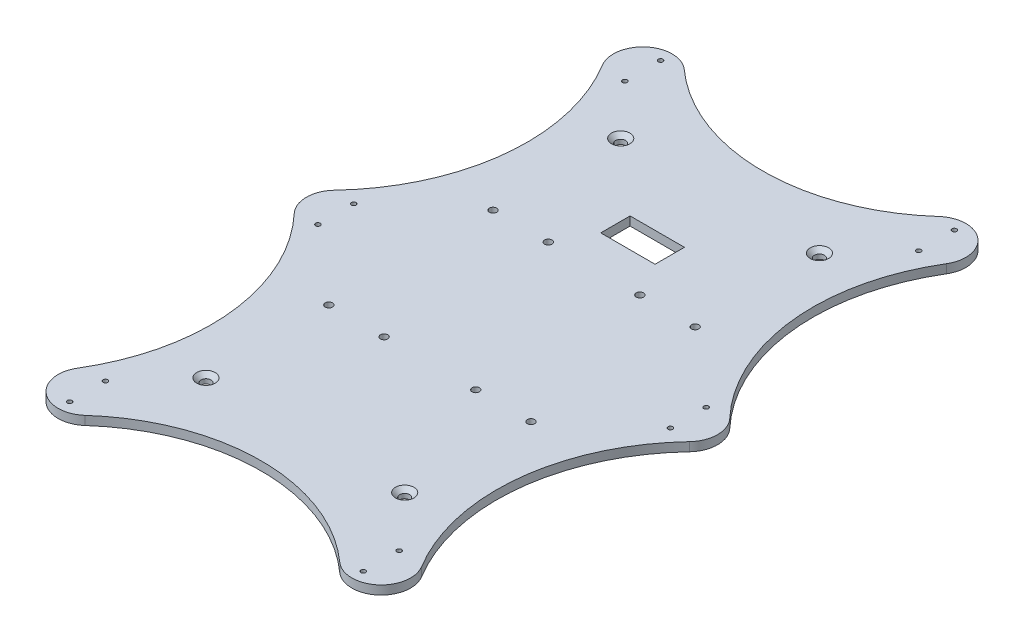
from build123d import *

# Parameters (mm, degrees)
SKETCH1_R                                      = 0.79375
SKETCH1_R_2                                    = 1.25
BOSS_EXTRUDE1_DEPTH                            = 3
CSK_FOR_M3_FLAT_HEAD_MACHINE_SCREW1_AT_2_COUNT = 2
CSK_FOR_M3_FLAT_HEAD_MACHINE_SCREW1_AT_2_PITCH = 67.658315793
CSK_FOR_M3_FLAT_HEAD_MACHINE_SCREW1_AT_3_COUNT = 2
CSK_FOR_M3_FLAT_HEAD_MACHINE_SCREW1_AT_3_PITCH = 141.2
CSK_FOR_M3_FLAT_HEAD_MACHINE_SCREW1_AT_4_COUNT = 2
CSK_FOR_M3_FLAT_HEAD_MACHINE_SCREW1_AT_4_PITCH = 156.572946884
CUT_EXTRUDE1_REACH                             = 127.831
SKETCH5_W                                      = 18.5
SKETCH5_H                                      = 10


with BuildPart() as part:
    # Sketch1 → Boss-Extrude1 (new body)
    with BuildSketch(Plane(origin=(0, 0, 0), x_dir=(1, 0, 0), z_dir=(0, 1, 0))):
        with BuildLine():
            ThreePointArc((-43.32807146, 101.968504868), (0, 85.401121174), (43.32807146, 101.968504868))
            ThreePointArc((43.32807146, 101.968504868), (56.388628204, 102.212861373), (58.547766972, 89.329695133))
            ThreePointArc((58.547766972, 89.329695133), (48.991933901, 46.624185339), (67.272511105, 6.8637149))
            ThreePointArc((67.272511105, 6.8637149), (70, 0), (67.272511105, -6.8637149))
            ThreePointArc((67.272511105, -6.8637149), (48.991933901, -46.624185339), (58.547766972, -89.329695133))
            ThreePointArc((58.547766972, -89.329695133), (56.388628204, -102.212861373), (43.32807146, -101.968504868))
            ThreePointArc((43.32807146, -101.968504868), (0, -85.401121174), (-43.32807146, -101.968504868))
            ThreePointArc((-43.32807146, -101.968504868), (-56.388628204, -102.212861373), (-58.547766972, -89.329695133))
            ThreePointArc((-58.547766972, -89.329695133), (-48.991933901, -46.624185339), (-67.272511105, -6.8637149))
            ThreePointArc((-67.272511105, -6.8637149), (-70, 0), (-67.272511105, 6.8637149))
            ThreePointArc((-67.272511105, 6.8637149), (-48.991933901, 46.624185339), (-58.547766972, 89.329695133))
            ThreePointArc((-58.547766972, 89.329695133), (-56.388628204, 102.212861373), (-43.32807146, 101.968504868))
        make_face()
        with Locations(Location((-60, -6.09, 0), (0, 0, 270))):
            Circle(SKETCH1_R, mode=Mode.SUBTRACT)
        with Locations(Location((-50, 88.429654651, 0), (0, 0, 270))):
            Circle(SKETCH1_R, mode=Mode.SUBTRACT)
        with Locations(Location((-50, 100.609654651, 0), (0, 0, 90))):
            Circle(SKETCH1_R, mode=Mode.SUBTRACT)
        with Locations(Location((-60, 6.09, 0), (0, 0, 90))):
            Circle(SKETCH1_R, mode=Mode.SUBTRACT)
        with Locations(Location((60, 6.09, 0), (0, 0, 270))):
            Circle(SKETCH1_R, mode=Mode.SUBTRACT)
        with Locations(Location((60, -6.09, 0), (0, 0, 90))):
            Circle(SKETCH1_R, mode=Mode.SUBTRACT)
        with Locations(Location((50, 88.429654651, 0), (0, 0, 90))):
            Circle(SKETCH1_R, mode=Mode.SUBTRACT)
        with Locations(Location((50, 100.609654651, 0), (0, 0, 270))):
            Circle(SKETCH1_R, mode=Mode.SUBTRACT)
        with Locations(Location((50, -88.429654651, 0), (0, 0, 270))):
            Circle(SKETCH1_R, mode=Mode.SUBTRACT)
        with Locations(Location((50, -100.609654651, 0), (0, 0, 90))):
            Circle(SKETCH1_R, mode=Mode.SUBTRACT)
        with Locations(Location((-50, -88.429654651, 0), (0, 0, 90))):
            Circle(SKETCH1_R, mode=Mode.SUBTRACT)
        with Locations(Location((-50, -100.609654651, 0), (0, 0, 270))):
            Circle(SKETCH1_R, mode=Mode.SUBTRACT)
        with Locations(Location((-34.4, 27.95, 0), (0, 0, 270))):
            Circle(SKETCH1_R_2, mode=Mode.SUBTRACT)
        with Locations(Location((-15.6, 27.95, 0), (0, 0, 270))):
            Circle(SKETCH1_R_2, mode=Mode.SUBTRACT)
        with Locations(Location((-34.4, -27.95, 0), (0, 0, 270))):
            Circle(SKETCH1_R_2, mode=Mode.SUBTRACT)
        with Locations(Location((-15.6, -27.95, 0), (0, 0, 270))):
            Circle(SKETCH1_R_2, mode=Mode.SUBTRACT)
        with Locations(Location((15.6, -27.95, 0), (0, 0, 90))):
            Circle(SKETCH1_R_2, mode=Mode.SUBTRACT)
        with Locations(Location((34.4, -27.95, 0), (0, 0, 90))):
            Circle(SKETCH1_R_2, mode=Mode.SUBTRACT)
        with Locations(Location((15.6, 27.95, 0), (0, 0, 90))):
            Circle(SKETCH1_R_2, mode=Mode.SUBTRACT)
        with Locations(Location((34.4, 27.95, 0), (0, 0, 90))):
            Circle(SKETCH1_R_2, mode=Mode.SUBTRACT)
    extrude(amount=BOSS_EXTRUDE1_DEPTH)

    # Sketch4 → CSK for M3 Flat Head Machine Screw1 (revolve, cut)
    with BuildSketch(Plane(origin=(-33.829157896, 3, -70.836811542), x_dir=(0, 0, 1), z_dir=(1, 0, 0))):
        Polygon((0, 0), (0, 3), (1.7, 3), (1.7, 1.45), (3.15, 0), align=None)
    csk_for_m3_flat_head_machine_screw1 = revolve(axis=Axis((-33.829157896, 9.35, -70.836811542), (0, -1, 0)), mode=Mode.SUBTRACT)

    # CSK for M3 Flat Head Machine Screw1 at 2: CSK for M3 Flat Head Machine Screw1 ×2
    with Locations(*[(i * CSK_FOR_M3_FLAT_HEAD_MACHINE_SCREW1_AT_2_PITCH, 0, 0) for i in range(1, CSK_FOR_M3_FLAT_HEAD_MACHINE_SCREW1_AT_2_COUNT)]):
        add(csk_for_m3_flat_head_machine_screw1, mode=Mode.SUBTRACT)

    # CSK for M3 Flat Head Machine Screw1 at 3: CSK for M3 Flat Head Machine Screw1 ×2
    with Locations(*[(0, 0, i * CSK_FOR_M3_FLAT_HEAD_MACHINE_SCREW1_AT_3_PITCH) for i in range(1, CSK_FOR_M3_FLAT_HEAD_MACHINE_SCREW1_AT_3_COUNT)]):
        add(csk_for_m3_flat_head_machine_screw1, mode=Mode.SUBTRACT)

    # CSK for M3 Flat Head Machine Screw1 at 4: CSK for M3 Flat Head Machine Screw1 ×2
    with Locations(*[Vector(0.4321200893208166, 0, 0.9018160723813751) * (i * CSK_FOR_M3_FLAT_HEAD_MACHINE_SCREW1_AT_4_PITCH) for i in range(1, CSK_FOR_M3_FLAT_HEAD_MACHINE_SCREW1_AT_4_COUNT)]):
        add(csk_for_m3_flat_head_machine_screw1, mode=Mode.SUBTRACT)

    # Sketch5 → Cut-Extrude1 (cut, up to next)
    with BuildSketch(Plane.XZ, mode=Mode.PRIVATE) as cut_extrude1_sk1:
        with Locations((-0.133157896, -44.586811542)):
            Rectangle(SKETCH5_W, SKETCH5_H)
    cut_extrude1_tool1 = extrude(cut_extrude1_sk1.sketch, amount=-CUT_EXTRUDE1_REACH, mode=Mode.PRIVATE) & part.part
    add(cut_extrude1_tool1.solids().sort_by_distance((-0.133158, 0, -44.586812))[0], mode=Mode.SUBTRACT)


solid = part.part
